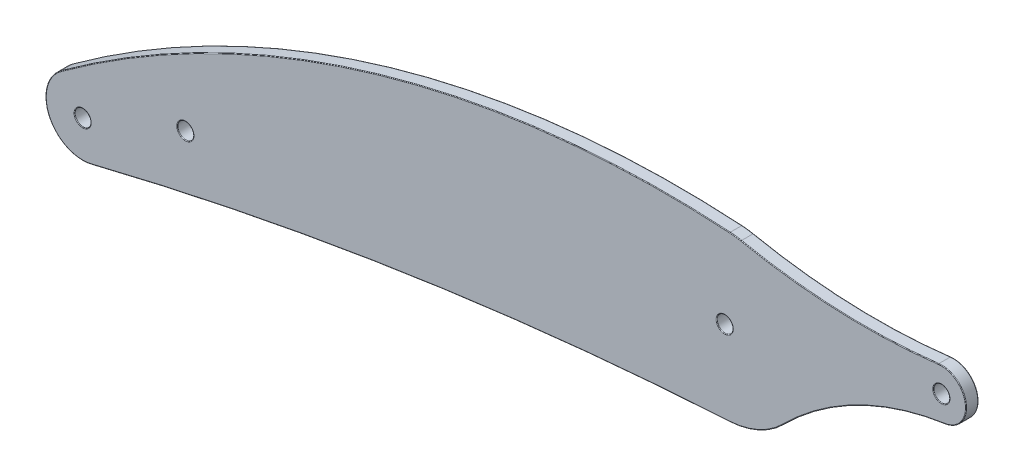
from build123d import *

# Parameters (mm, degrees)
BOSS_EXTRUDE1_DEPTH        = 3
M3_5_CLEARANCE_HOLE1_D     = 3.9
M3_5_CLEARANCE_HOLE1_DEPTH = 10
M3_5_CLEARANCE_HOLE1_TIP   = 1.171678207
FILLET1_R                  = 0.15


with BuildPart() as part:
    # Sketch1 → Boss-Extrude1 (new body)
    with BuildSketch(Plane.XY):
        with BuildLine():
            ThreePointArc((-174.462073609, 162.200582347), (-97.40794844, 177.496181026), (-19.270785815, 185.612668032))
            ThreePointArc((-19.270785815, 185.612668032), (-12.215961432, 187.338041165), (-6.242425057, 191.4689397))
            ThreePointArc((-6.242425057, 191.4689397), (11.860132573, 204.590718457), (33.176625244, 211.335406045))
            ThreePointArc((33.176625244, 211.335406045), (38.250302898, 218.068129213), (31.583549811, 223.228184393))
            ThreePointArc((31.583549811, 223.228184393), (7.505603441, 222.267982746), (-16.415402052, 225.175728416))
            ThreePointArc((-16.415402052, 225.175728416), (-17.780851121, 225.405550653), (-19.158929463, 225.540344964))
            ThreePointArc((-19.158929463, 225.540344964), (-104.669481606, 216.092378887), (-181.914127241, 178.216485348))
            ThreePointArc((-181.914127241, 178.216485348), (-184.780430481, 167.141182782), (-174.462073609, 162.200582347))
        make_face()
    extrude(amount=-BOSS_EXTRUDE1_DEPTH)

    # M3.5 Clearance Hole1
    with Locations(Plane.XY):
        with Locations((32.303419496, 217.271525293), (-20.415696686, 205.579870617), (-52.165696686, -1330.164308971), (-151.620485371, 180.705519261), (-176.620485371, 170.937930838)):
            Hole(M3_5_CLEARANCE_HOLE1_D / 2, depth=M3_5_CLEARANCE_HOLE1_DEPTH)
            with Locations((0, 0, -(M3_5_CLEARANCE_HOLE1_DEPTH + M3_5_CLEARANCE_HOLE1_TIP / 2))):  # 118° drill point
                Cone(0, M3_5_CLEARANCE_HOLE1_D / 2, M3_5_CLEARANCE_HOLE1_TIP, mode=Mode.SUBTRACT)

    # Fillet1
    fillet1_edges = [part.edges().sort_by_distance(p)[0] for p in [
        (-12.215961432, 187.338041165, -3),
        (-97.40794844, 177.496181026, 0),
        (-184.780430481, 167.141182782, 0),
        (11.860132573, 204.590718457, -3),
        (38.250302898, 218.068129213, -3),
        (7.505603441, 222.267982746, -3),
        (-17.780851121, 225.405550653, -3),
        (-104.669481606, 216.092378887, -3),
        (-174.670485371, 170.937930838, -3),
        (-174.670485371, 170.937930838, 0),
        (-149.670485371, 180.705519261, -3),
        (-149.670485371, 180.705519261, 0),
        (-18.465696686, 205.579870617, -3),
        (-18.465696686, 205.579870617, 0),
        (-184.780430481, 167.141182782, -3),
        (34.253419496, 217.271525293, -3),
        (34.253419496, 217.271525293, 0),
        (-97.40794844, 177.496181026, -3),
        (-104.669481606, 216.092378887, 0),
        (-17.780851121, 225.405550653, 0),
        (7.505603441, 222.267982746, 0),
        (38.250302898, 218.068129213, 0),
        (11.860132573, 204.590718457, 0),
        (-12.215961432, 187.338041165, 0),
    ]]
    fillet(fillet1_edges, radius=FILLET1_R)


solid = part.part
